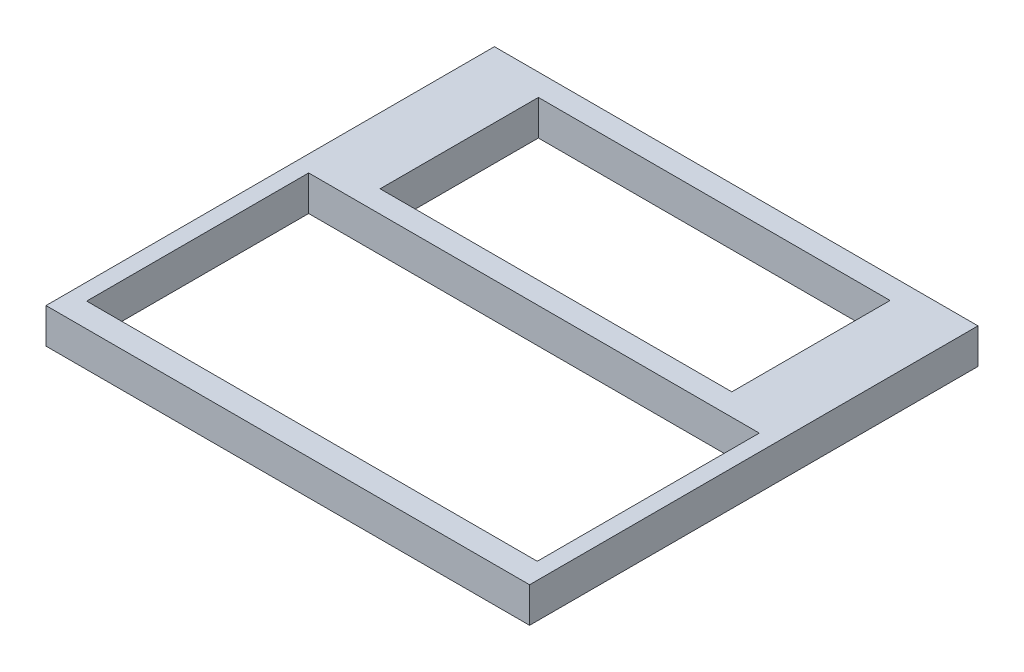
from build123d import *

# Parameters (mm, degrees)
SKETCH1_W           = 110
SKETCH1_H           = 102
SKETCH1_W_2         = 80
SKETCH1_H_2         = 36
BOSS_EXTRUDE1_DEPTH = 8
SKETCH2_W           = 102.5
SKETCH2_H           = 50.5
CUT_EXTRUDE1_DEPTH  = 8


with BuildPart() as part:
    # Sketch1 → Boss-Extrude1 (new body)
    with BuildSketch(Plane(origin=(0, 0, 0), x_dir=(1, 0, 0), z_dir=(0, 1, 0))):
        Rectangle(SKETCH1_W, SKETCH1_H)
        with Locations((0, 28)):
            Rectangle(SKETCH1_W_2, SKETCH1_H_2, mode=Mode.SUBTRACT)
    extrude(amount=BOSS_EXTRUDE1_DEPTH)

    # Sketch2 → Cut-Extrude1 (cut)
    with BuildSketch(Plane(origin=(0, 8, 0), x_dir=(1, 0, 0), z_dir=(0, 1, 0))):
        with Locations((0, -20.25)):
            Rectangle(SKETCH2_W, SKETCH2_H)
    extrude(amount=-CUT_EXTRUDE1_DEPTH, mode=Mode.SUBTRACT)


solid = part.part
